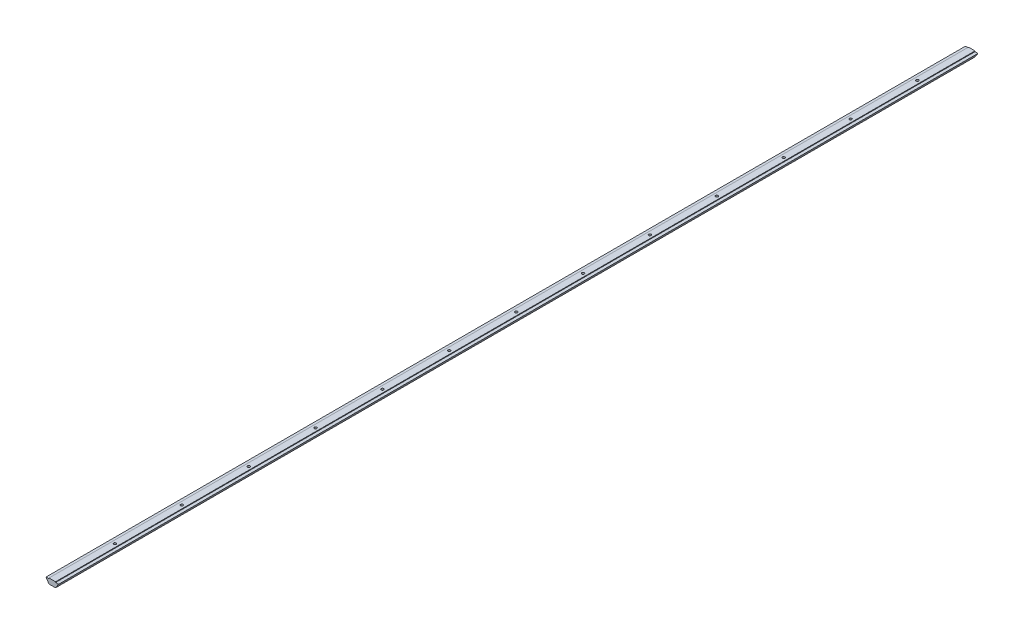
from build123d import *

# Parameters (mm, degrees)
BOSS_EXTRUDE1_DEPTH = 1100
SKETCH2_R           = 1.5
CUT_EXTRUDE1_DEPTH  = 1101.043608227


with BuildPart() as part:
    # Sketch1 → Boss-Extrude1 (new body)
    with BuildSketch(Plane.XY):
        Polygon((3.9, 0), (-3.9, 0), (-7.5, 5.5), (-3.9, 5.5), (-3.9, 6.3), (3.9, 6.3), (3.9, 5.5), (7.5, 5.5), align=None)
    extrude(amount=BOSS_EXTRUDE1_DEPTH)

    # Sketch2 → Cut-Extrude1 (cut, through all)
    with BuildSketch(Plane(origin=(0, 6.3, 0), x_dir=(1, 0, 0), z_dir=(0, 1, 0))):
        with Locations(Location((0, -65, 0), (0, 0, 270))):
            Circle(SKETCH2_R)
        with Locations(Location((0, -145, 0), (0, 0, 270))):
            Circle(SKETCH2_R)
        with Locations(Location((0, -225, 0), (0, 0, 270))):
            Circle(SKETCH2_R)
        with Locations(Location((0, -305, 0), (0, 0, 270))):
            Circle(SKETCH2_R)
        with Locations(Location((0, -385, 0), (0, 0, 270))):
            Circle(SKETCH2_R)
        with Locations(Location((0, -465, 0), (0, 0, 270))):
            Circle(SKETCH2_R)
        with Locations(Location((0, -545, 0), (0, 0, 270))):
            Circle(SKETCH2_R)
        with Locations(Location((0, -625, 0), (0, 0, 270))):
            Circle(SKETCH2_R)
        with Locations(Location((0, -705, 0), (0, 0, 270))):
            Circle(SKETCH2_R)
        with Locations(Location((0, -785, 0), (0, 0, 270))):
            Circle(SKETCH2_R)
        with Locations(Location((0, -865, 0), (0, 0, 270))):
            Circle(SKETCH2_R)
        with Locations(Location((0, -945, 0), (0, 0, 270))):
            Circle(SKETCH2_R)
        with Locations(Location((0, -1025, 0), (0, 0, 270))):
            Circle(SKETCH2_R)
    extrude(amount=-CUT_EXTRUDE1_DEPTH, mode=Mode.SUBTRACT)


solid = part.part
